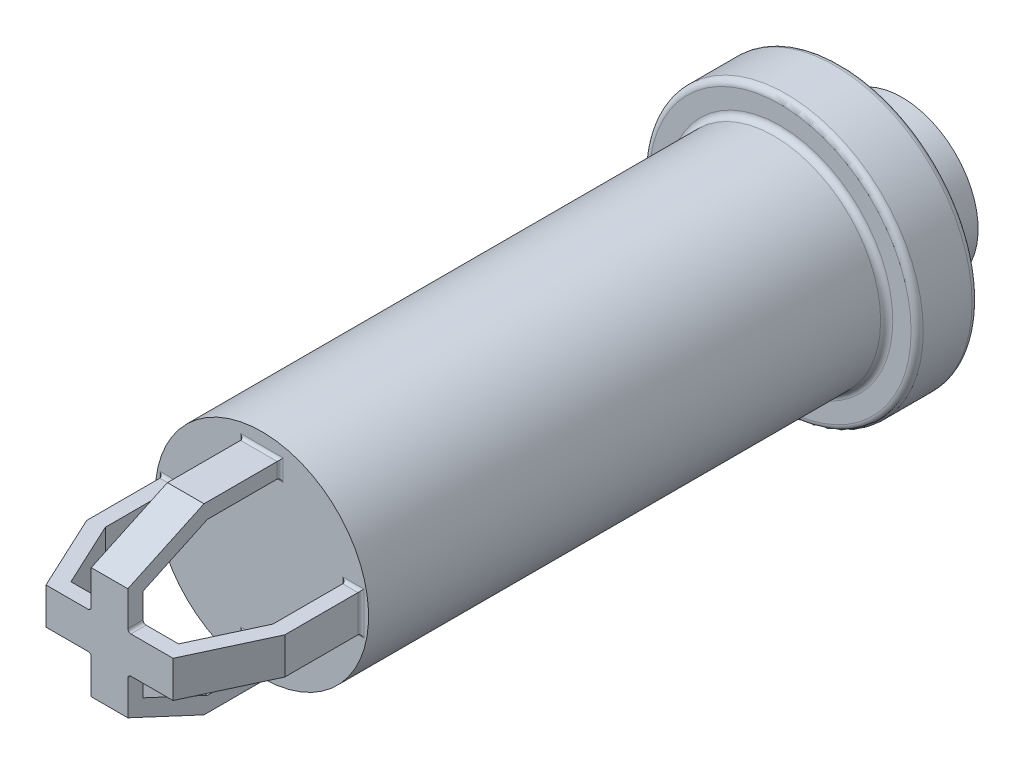
from build123d import *

# Parameters (mm, degrees)
BOSS_EXTRUDE1_DEPTH = 6
BOSS_EXTRUDE2_DEPTH = 6
FILLET2_R           = 1
FILLET3_R           = 2
FILLET4_R           = 2


with BuildPart() as part:
    # Sketch1 → Revolve1 (revolve)
    with BuildSketch(Plane(origin=(0, 0, 0), x_dir=(1, 0, 0), z_dir=(0, 1, 0))):
        Polygon((0, 260), (-25, 260), (-25, 240), (-45, 240), (-45, 220), (-35, 220), (-35, 50), (0, 50), align=None)
    revolve(axis=Axis((0, 0, -296.761273665), (0, 0, 1)))

    # Sketch5 → Boss-Extrude1 (add, symmetric)
    with BuildSketch(Plane(origin=(0, 0, 0), x_dir=(1, 0, 0), z_dir=(0, 1, 0))):
        Polygon((-32.5, 50), (-32.5, 25), (-20.842308546, 0), (20.842308546, 0), (32.5, 25), (32.5, 50), (27.5, 50), (27.5, 26.108473313), (17.656957242, 5), (-17.656957242, 5), (-27.5, 26.108473313), (-27.5, 50), align=None)
    extrude(amount=BOSS_EXTRUDE1_DEPTH, both=True)

    # Sketch7 → Boss-Extrude2 (add, symmetric)
    with BuildSketch(Plane(origin=(0, 0, 0), x_dir=(0, 0, -1), z_dir=(1, 0, 0))):
        Polygon((50, 30), (25, 30), (0, 18.342308546), (0, -18.342308546), (25, -30), (50, -30), (50, -25), (26.108473313, -25), (5, -15.156957242), (5, 15.156957242), (26.108473313, 25), (50, 25), align=None)
    extrude(amount=BOSS_EXTRUDE2_DEPTH, both=True)

    # Sketch8 → Cut-Revolve1 (revolve, cut)
    with BuildSketch(Plane(origin=(0, 0, 0), x_dir=(1, 0, 0), z_dir=(0, 1, 0))):
        Polygon((-25, 220), (-15, 220), (-15, 260), (0, 260), (0, 60), (-25, 60), align=None)
    revolve(axis=Axis((0, 0, -287.049474382), (0, 0, 1)), mode=Mode.SUBTRACT)

    # Fillet2
    fillet2_edges = [part.edges().sort_by_distance(p)[0] for p in [
        (-30, -6, -50),
        (-27.5, 0, -50),
        (-32.5, 0, -50),
        (30, -6, -50),
        (32.5, 0, -50),
        (27.5, 0, -50),
        (-30, 6, -50),
        (30, 6, -50),
        (-6, -6, -2.5),
        (6, -6, -2.5),
        (6, 6, -2.5),
        (6, 27.5, -50),
        (-6, 6, -2.5),
        (-6, 27.5, -50),
        (0, 25, -50),
        (0, 30, -50),
        (-6, -27.5, -50),
        (0, -30, -50),
        (0, -25, -50),
        (6, -27.5, -50),
    ]]
    fillet(fillet2_edges, radius=FILLET2_R)

    # Fillet3
    fillet3_edges = [part.edges().sort_by_distance(p)[0] for p in [
        (35, 0, -220),
        (25, 0, -240),
    ]]
    fillet(fillet3_edges, radius=FILLET3_R)

    # Fillet4
    fillet4_edges = [part.edges().sort_by_distance(p)[0] for p in [
        (25, 0, -60),
        (25, 0, -220),
        (45, 0, -220),
        (45, 0, -240),
    ]]
    fillet(fillet4_edges, radius=FILLET4_R)


solid = part.part
